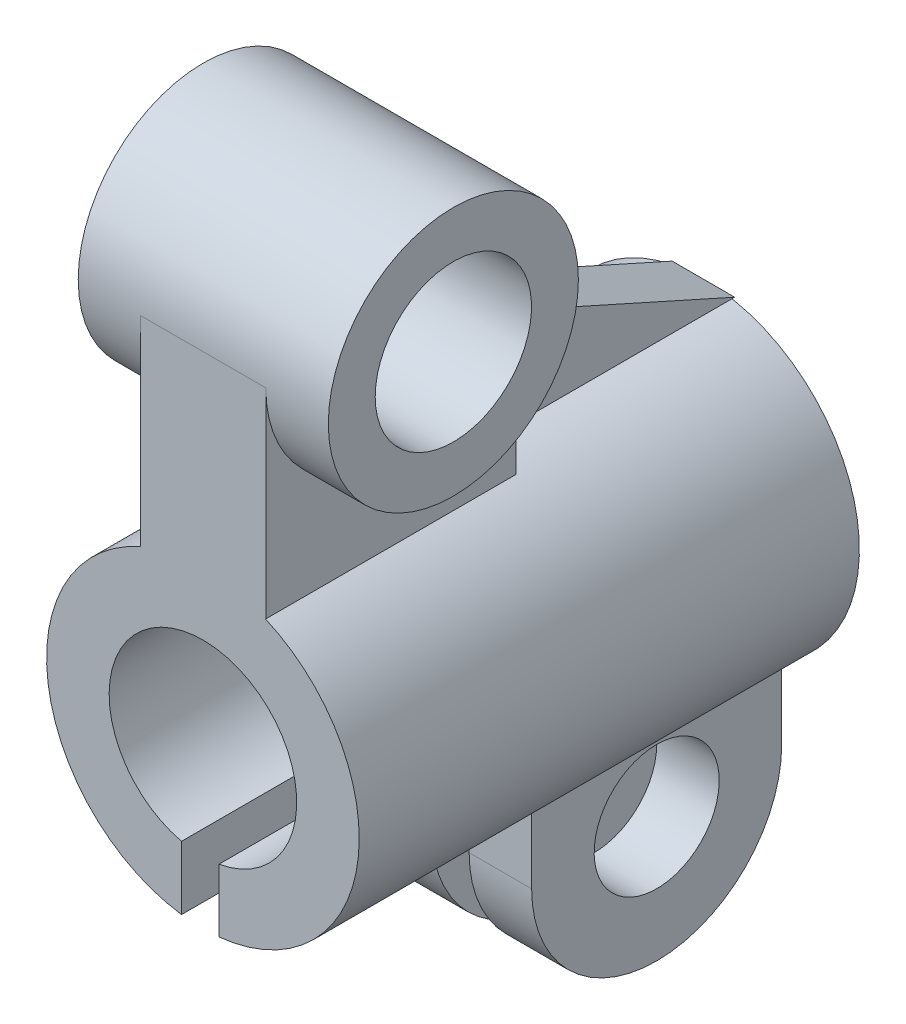
from build123d import *

# Parameters (mm, degrees)
IZIM1_R                     = 25
IZIM1_R_2                   = 15
Y_KSEKLIK_EKSTR_ZYON1_DEPTH = 80
IZIM3_W                     = 26
IZIM3_H                     = 32
Y_KSEKLIK_EKSTR_ZYON3_DEPTH = 40
RADYUS2_RADIUS              = 20
RADYUS2_LENGTH              = 26
IZIM5_W                     = 6
IZIM5_H                     = 44.006307857
KES_EKSTR_ZYON1_DEPTH       = 107.133079222
KES_EKSTR_ZYON2_DEPTH       = 100.800958853
KES_EKSTR_ZYON2_DEPTH_BACK  = 100.800958853
IZIM7_R                     = 10
IZIM9_W                     = 20
IZIM9_H                     = 32
Y_KSEKLIK_EKSTR_ZYON4_DEPTH = 40
Y_KSEKLIK_EKSTR_ZYON5_DEPTH = 5
IZIM11_R                    = 20
IZIM11_R_2                  = 12.5
Y_KSEKLIK_EKSTR_ZYON6_DEPTH = 20
KES_EKSTR_ZYON3_DEPTH       = 130.453305469
KES_EKSTR_ZYON3_DEPTH_BACK  = 130.453305469
IZIM12_R                    = 12.5


with BuildPart() as part:
    # Çizim1 → Yükseklik-Ekstrüzyon1 (new body)
    with BuildSketch(Plane.XY):
        with Locations((-27.727849989, 20.650896384)):
            Circle(IZIM1_R)
        with Locations((-27.727849989, 20.650896384)):
            Circle(IZIM1_R_2, mode=Mode.SUBTRACT)
    extrude(amount=Y_KSEKLIK_EKSTR_ZYON1_DEPTH)

    # Çizim3 → Yükseklik-Ekstrüzyon3 (add)
    with BuildSketch(Plane(origin=(0, 0, 0), x_dir=(-1, 0, 0), z_dir=(0, 0, -1))):
        with Locations((28.149550203, -16.534219889)):
            Rectangle(IZIM3_W, IZIM3_H)
    extrude(amount=-Y_KSEKLIK_EKSTR_ZYON3_DEPTH)

    # Radyus2: full round fillet: the end face becomes a half cylinder, R = half its width
    radyus2_face = Plane((-28.149550203, -32.534219889, 20), x_dir=(-1, 0, 0), z_dir=(0, -1, 0))  # on the end face: x along it, z out of the body
    radyus2_slab = radyus2_face.offset(-RADYUS2_RADIUS / 2) * Box(RADYUS2_LENGTH, 2 * RADYUS2_RADIUS, RADYUS2_RADIUS, mode=Mode.PRIVATE)  # the body's end, R deep
    radyus2_round = Plane((-28.149550203, -12.534219889, 20), x_dir=(0, -1, 0), z_dir=(-1, 0, 0)) * Cylinder(RADYUS2_RADIUS, RADYUS2_LENGTH, mode=Mode.PRIVATE)  # its axis R under the face
    add(radyus2_slab - radyus2_round, mode=Mode.SUBTRACT)

    # Çizim5 → Kes-Ekstrüzyon1 (cut, through all)
    with BuildSketch(Plane(origin=(0, 0, 0), x_dir=(-1, 0, 0), z_dir=(0, 0, -1))):
        with Locations((28.149550203, -10.53106596)):
            Rectangle(IZIM5_W, IZIM5_H)
    extrude(amount=-KES_EKSTR_ZYON1_DEPTH, mode=Mode.SUBTRACT)

    # Çizim7 → Kes-Ekstrüzyon2 (cut, two sides: drawn at the far end of the back side and taken through both)
    with BuildSketch(Plane.ZY.offset(41.149550203).offset(-KES_EKSTR_ZYON2_DEPTH_BACK)):
        with Locations(Location((20, -12.534219889, 0), (0, 0, 90))):
            Circle(IZIM7_R)
    extrude(amount=KES_EKSTR_ZYON2_DEPTH + KES_EKSTR_ZYON2_DEPTH_BACK, mode=Mode.SUBTRACT)

    # Çizim9 → Yükseklik-Ekstrüzyon4 (add)
    with BuildSketch(Plane.XY.offset(80)):
        with Locations((-27.673094682, 59.587594228)):
            Rectangle(IZIM9_W, IZIM9_H)
    extrude(amount=-Y_KSEKLIK_EKSTR_ZYON4_DEPTH)

    # Çizim10 → Yükseklik-Ekstrüzyon5 (add, symmetric)
    with BuildSketch(Plane.ZY.offset(27.673094682)):
        Polygon((0, 45.650896384), (40, 63.587594228), (40, 45.639566476), align=None)
    extrude(amount=Y_KSEKLIK_EKSTR_ZYON5_DEPTH, both=True)

    # Çizim11 → Yükseklik-Ekstrüzyon6 (add, symmetric)
    with BuildSketch(Plane.ZY.offset(27.673094682)):
        with Locations((60, 75.587594228)):
            Circle(IZIM11_R)
        with Locations((60, 75.587594228)):
            Circle(IZIM11_R_2, mode=Mode.SUBTRACT)
    extrude(amount=Y_KSEKLIK_EKSTR_ZYON6_DEPTH, both=True)

    # Çizim12 → Kes-Ekstrüzyon3 (cut, two sides: drawn at the far end of the back side and taken through both)
    with BuildSketch(Plane.ZY.offset(37.673094682).offset(-KES_EKSTR_ZYON3_DEPTH_BACK)):
        with Locations((60, 75.587594228)):
            Circle(IZIM12_R)
    extrude(amount=KES_EKSTR_ZYON3_DEPTH + KES_EKSTR_ZYON3_DEPTH_BACK, mode=Mode.SUBTRACT)


solid = part.part
